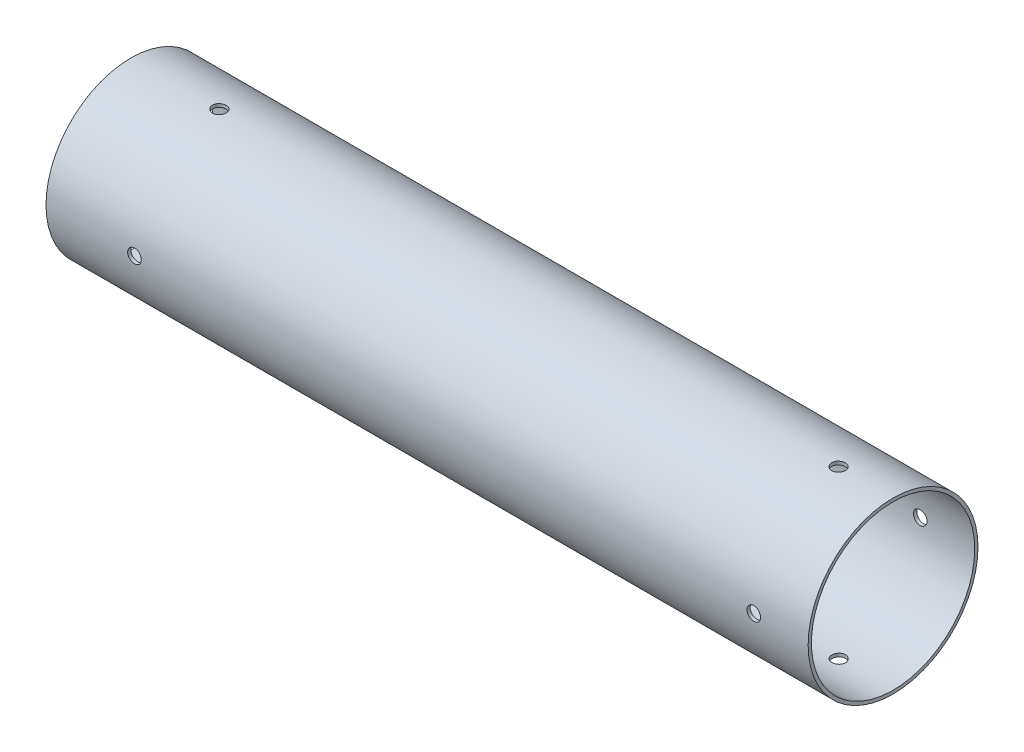
from build123d import *

# Parameters (mm, degrees)
SKETCH1_R           = 39.624
SKETCH1_R_2         = 38.1
BOSS_EXTRUDE1_DEPTH = 355.6
SKETCH2_R           = 3.175
CUT_EXTRUDE1_DEPTH  = 360.988170295
CIRPATTERN1_COUNT   = 4
SKETCH3_R           = 3.175
CUT_EXTRUDE2_DEPTH  = 360.988170415
CIRPATTERN2_COUNT   = 4


with BuildPart() as part:
    # Sketch1 → Boss-Extrude1 (new body)
    with BuildSketch(Plane.YZ):
        with Locations(Location((0, 0, 0), (0, 0, 270))):
            Circle(SKETCH1_R)
        with Locations(Location((0, 0, 0), (0, 0, 270))):
            Circle(SKETCH1_R_2, mode=Mode.SUBTRACT)
    extrude(amount=BOSS_EXTRUDE1_DEPTH)

    # Sketch2 → Cut-Extrude1 (cut, through all)
    with BuildSketch(Plane(origin=(0, 0, 0), x_dir=(-1, 0, 0), z_dir=(0, 1, 0))):
        with Locations(Location((-330.2, 0, 0), (0, 0, 270))):
            Circle(SKETCH2_R)
    cut_extrude1 = extrude(amount=CUT_EXTRUDE1_DEPTH, mode=Mode.SUBTRACT)

    # CirPattern1: Cut-Extrude1 ×4 about axis
    cirpattern1_axis = Axis((355.6, 0, 0), (-1, 0, 0))
    for i in range(1, CIRPATTERN1_COUNT):
        add(cut_extrude1.rotate(cirpattern1_axis, i * 360 / CIRPATTERN1_COUNT), mode=Mode.SUBTRACT)

    # Sketch3 → Cut-Extrude2 (cut, through all)
    with BuildSketch(Plane(origin=(0, 0, 0), x_dir=(-1, 0, 0), z_dir=(0, 1, 0))):
        with Locations(Location((-41.275, 0, 0), (0, 0, 270))):
            Circle(SKETCH3_R)
    cut_extrude2 = extrude(amount=CUT_EXTRUDE2_DEPTH, mode=Mode.SUBTRACT)

    # CirPattern2: Cut-Extrude2 ×4 about axis
    cirpattern2_axis = Axis((355.6, 0, 0), (-1, 0, 0))
    for i in range(1, CIRPATTERN2_COUNT):
        add(cut_extrude2.rotate(cirpattern2_axis, i * 360 / CIRPATTERN2_COUNT), mode=Mode.SUBTRACT)


solid = part.part
